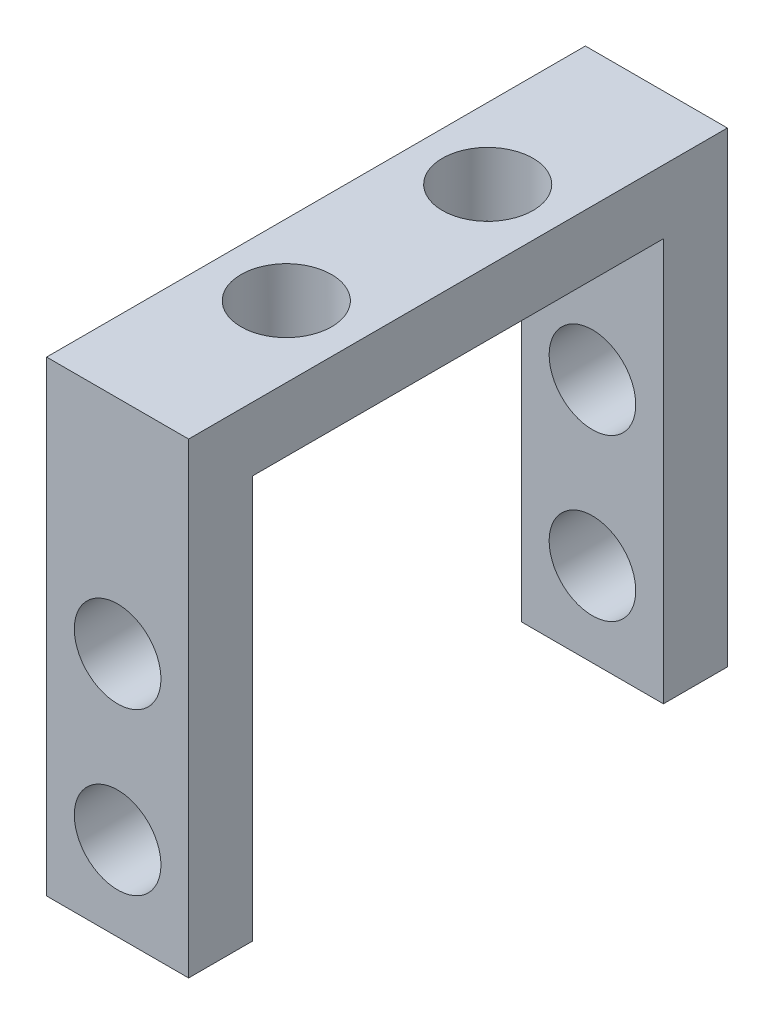
from build123d import *

# Parameters (mm, degrees)
SKETCH2_W           = 7.05
SKETCH2_H           = 26.75
BOSS_EXTRUDE1_DEPTH = 3.175
SKETCH3_W           = 7.05
SKETCH3_H           = 3.175
BOSS_EXTRUDE2_DEPTH = 20
SKETCH4_R           = 2.25
CUT_EXTRUDE1_DEPTH  = 3.175
SKETCH5_R           = 2.15
CUT_EXTRUDE2_DEPTH  = 34.585534461


with BuildPart() as part:
    # Sketch2 → Boss-Extrude1 (new body)
    with BuildSketch(Plane(origin=(0, 0, 0), x_dir=(1, 0, 0), z_dir=(0, 1, 0))):
        Rectangle(SKETCH2_W, SKETCH2_H)
    extrude(amount=BOSS_EXTRUDE1_DEPTH)

    # Sketch3 → Boss-Extrude2 (add)
    with BuildSketch(Plane.XZ):
        with Locations((0, 11.7875)):
            Rectangle(SKETCH3_W, SKETCH3_H)
        with Locations((0, -11.7875)):
            Rectangle(SKETCH3_W, SKETCH3_H)
    extrude(amount=BOSS_EXTRUDE2_DEPTH)

    # Sketch4 → Cut-Extrude1 (cut)
    with BuildSketch(Plane(origin=(0, 3.175, 0), x_dir=(1, 0, 0), z_dir=(0, 1, 0))):
        with Locations(Location((0, 5, 0), (0, 0, 270))):
            Circle(SKETCH4_R)
        with Locations(Location((0, -5, 0), (0, 0, 270))):
            Circle(SKETCH4_R)
    extrude(amount=-CUT_EXTRUDE1_DEPTH, mode=Mode.SUBTRACT)

    # Sketch5 → Cut-Extrude2 (cut, through all)
    with BuildSketch(Plane(origin=(0, 0, -13.375), x_dir=(-1, 0, 0), z_dir=(0, 0, -1))):
        with Locations((0, -7.825)):
            Circle(SKETCH5_R)
        with Locations((0, -15.825)):
            Circle(SKETCH5_R)
    extrude(amount=-CUT_EXTRUDE2_DEPTH, mode=Mode.SUBTRACT)


solid = part.part
